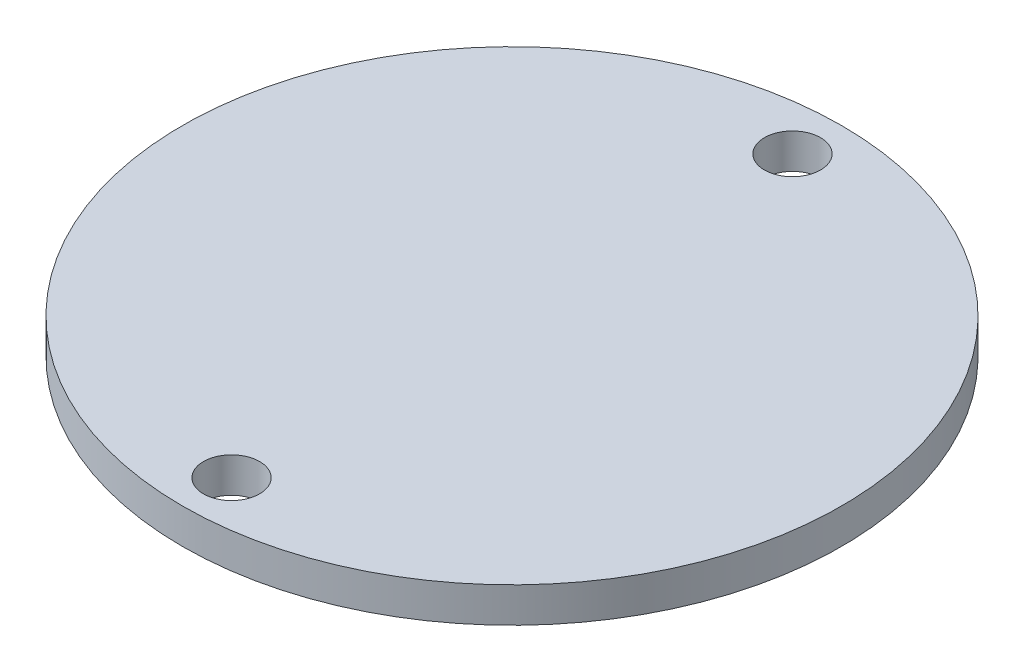
from build123d import *

# Parameters (mm, degrees)
ESBO_O1_R                = 23.5
ESBO_O1_R_2              = 2
RESSALTO_EXTRUS_O1_DEPTH = 2.5


with BuildPart() as part:
    # Esboço1 → Ressalto-extrusão1 (new body)
    with BuildSketch(Plane(origin=(0, 0, 0), x_dir=(1, 0, 0), z_dir=(0, 1, 0))):
        with Locations(Location((0, 0, 0), (0, 0, 270))):
            Circle(ESBO_O1_R)
        with Locations(Location((0, -20, 0), (0, 0, 270))):
            Circle(ESBO_O1_R_2, mode=Mode.SUBTRACT)
        with Locations(Location((0, 20, 0), (0, 0, 270))):
            Circle(ESBO_O1_R_2, mode=Mode.SUBTRACT)
    extrude(amount=RESSALTO_EXTRUS_O1_DEPTH)


solid = part.part
